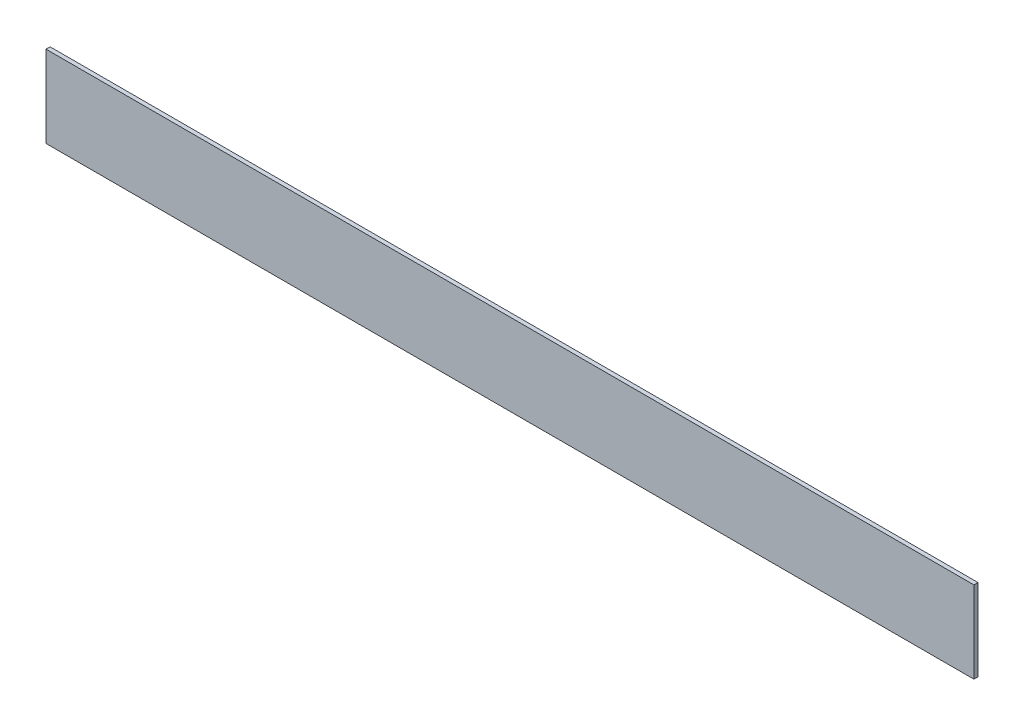
from build123d import *

# Parameters (mm, degrees)
SKETCH1_W           = 2271.75
SKETCH1_H           = 200
BOSS_EXTRUDE1_DEPTH = 10


with BuildPart() as part:
    # Sketch1 → Boss-Extrude1 (new body)
    with BuildSketch(Plane.XY):
        Rectangle(SKETCH1_W, SKETCH1_H)
    extrude(amount=BOSS_EXTRUDE1_DEPTH)


solid = part.part
